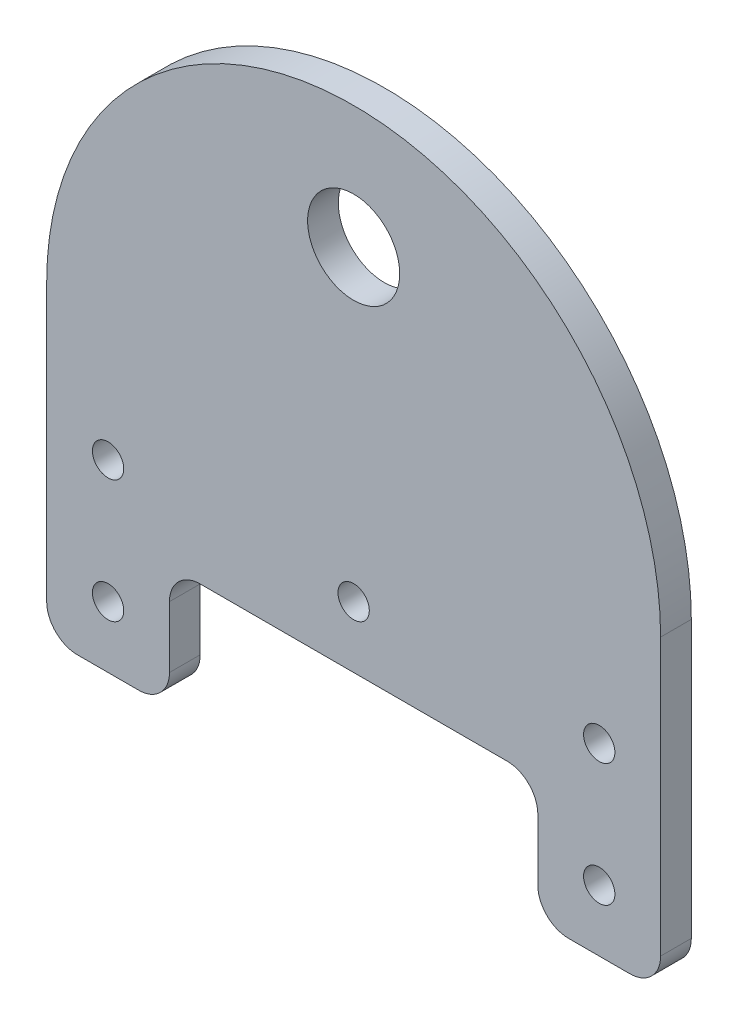
from build123d import *

# Parameters (mm, degrees)
SKETCH_1_R      = 7.5
SKETCH_1_R_2    = 2.55
EXTRUDE_1_DEPTH = 5
SKETCH_2_W      = 20
SKETCH_2_H      = 20
SKETCH_2_R      = 2.55
EXTRUDE_2_DEPTH = 5
FILLET_1_R      = 5


with BuildPart() as part:
    # ｽｹｯﾁ1 → ﾎﾞｽ - 押し出し1 (new body)
    with BuildSketch(Plane.XY):
        with BuildLine():
            Line((-50, -60), (50, -60))
            Line((50, -60), (50, -30))
            ThreePointArc((50, -30), (0, 20), (-50, -30))
            Line((-50, -30), (-50, -60))
        make_face()
        Circle(SKETCH_1_R, mode=Mode.SUBTRACT)
        with Locations((-40, -50)):
            Circle(SKETCH_1_R_2, mode=Mode.SUBTRACT)
        with Locations((0, -50)):
            Circle(SKETCH_1_R_2, mode=Mode.SUBTRACT)
        with Locations((40, -50)):
            Circle(SKETCH_1_R_2, mode=Mode.SUBTRACT)
    extrude(amount=EXTRUDE_1_DEPTH)

    # ｽｹｯﾁ2 → ﾎﾞｽ - 押し出し2 (add)
    # profile 1 of 2: a face of its own
    with BuildSketch(Plane.XY.offset(5)):
        with Locations((-40, -70)):
            Rectangle(SKETCH_2_W, SKETCH_2_H)
        with Locations((-40, -70)):
            Circle(SKETCH_2_R, mode=Mode.SUBTRACT)
    # profile 2 of 2: a face of its own
    with BuildSketch(Plane.XY.offset(5)):
        with Locations((40, -70)):
            Rectangle(SKETCH_2_W, SKETCH_2_H)
        with Locations(Location((40, -70, 0), (0, 0, 180))):
            Circle(SKETCH_2_R, mode=Mode.SUBTRACT)
    extrude(amount=-EXTRUDE_2_DEPTH)

    # ﾌｨﾚｯﾄ1
    fillet_1_edges = [part.edges().sort_by_distance(p)[0] for p in [
        (-50, -80, 2.5),
        (-30, -60, 2.5),
        (-30, -80, 2.5),
        (30, -60, 2.5),
        (50, -80, 2.5),
        (30, -80, 2.5),
    ]]
    fillet(fillet_1_edges, radius=FILLET_1_R)


solid = part.part
